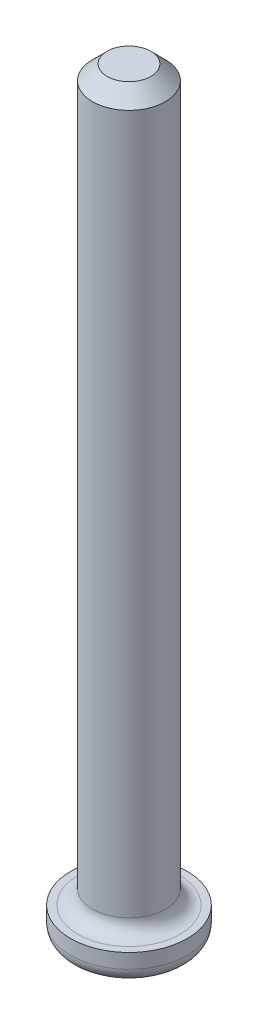
from build123d import *

# Parameters (mm, degrees)
SKETCH1_R           = 4
BOSS_EXTRUDE1_DEPTH = 2
SKETCH2_R           = 2.5
BOSS_EXTRUDE2_DEPTH = 50
FILLET1_R           = 1
CHAMFER1_SIZE       = 1
FILLET2_R           = 1


with BuildPart() as part:
    # Sketch1 → Boss-Extrude1 (new body)
    with BuildSketch(Plane(origin=(0, 0, 0), x_dir=(1, 0, 0), z_dir=(0, 1, 0))):
        with Locations(Location((0, 0, 0), (0, 0, 270))):
            Circle(SKETCH1_R)
    extrude(amount=BOSS_EXTRUDE1_DEPTH)

    # Sketch2 → Boss-Extrude2 (add)
    with BuildSketch(Plane(origin=(0, 2, 0), x_dir=(1, 0, 0), z_dir=(0, 1, 0))):
        with Locations(Location((0, 0, 0), (0, 0, 270))):
            Circle(SKETCH2_R)
    extrude(amount=BOSS_EXTRUDE2_DEPTH)

    # Fillet1
    fillet1_edges = [part.edges().sort_by_distance(p)[0] for p in [
        (0, 2, -2.5),
    ]]
    fillet(fillet1_edges, radius=FILLET1_R)

    # Chamfer1
    chamfer1_edges = [part.edges().sort_by_distance(p)[0] for p in [
        (0, 52, -2.5),
    ]]
    chamfer(chamfer1_edges, length=CHAMFER1_SIZE)

    # Fillet2
    fillet2_edges = [part.edges().sort_by_distance(p)[0] for p in [
        (0, 0, -4),
    ]]
    fillet(fillet2_edges, radius=FILLET2_R)


solid = part.part
